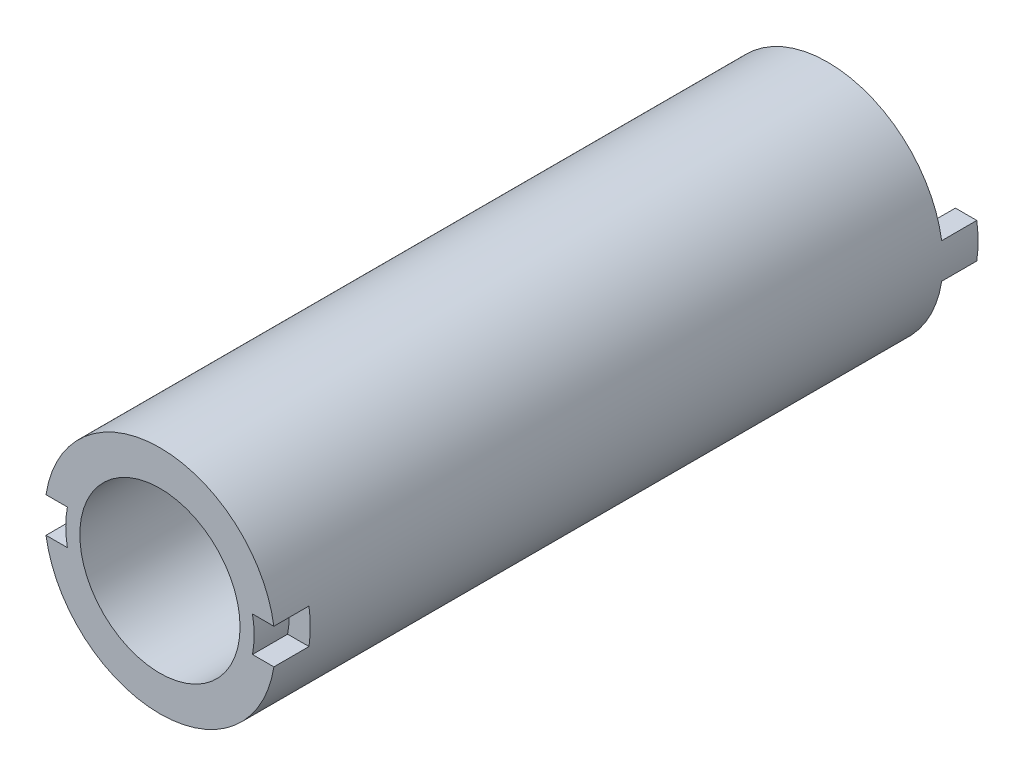
from build123d import *

# Parameters (mm, degrees)
SKETCH1_R           = 16.4
SKETCH1_R_2         = 11.4
BOSS_EXTRUDE1_DEPTH = 95
BOSS_EXTRUDE2_START = 5
BOSS_EXTRUDE2_DEPTH = 5
CUT_EXTRUDE1_START  = -5
CUT_EXTRUDE1_DEPTH  = 5


with BuildPart() as part:
    # Sketch1 → Boss-Extrude1 (new body)
    with BuildSketch(Plane.XY):
        Circle(SKETCH1_R)
        Circle(SKETCH1_R_2, mode=Mode.SUBTRACT)
    extrude(amount=BOSS_EXTRUDE1_DEPTH)

    # Sketch3 → Boss-Extrude2 (add)
    with BuildSketch(Plane(origin=(0, 0, 0), x_dir=(-1, 0, 0), z_dir=(0, 0, -1)).offset(BOSS_EXTRUDE2_START)):
        with BuildLine():
            Line((13.164725595, 2.5), (16.208331191, 2.5))
            ThreePointArc((16.208331191, 2.5), (16.4, 0), (16.208331191, -2.5))
            Line((16.208331191, -2.5), (13.164725595, -2.5))
            ThreePointArc((13.164725595, -2.5), (13.4, 0), (13.164725595, 2.5))
        make_face()
        with BuildLine():
            Line((-16.208331191, 2.5), (-13.164725595, 2.5))
            ThreePointArc((-13.164725595, 2.5), (-13.4, 0), (-13.164725595, -2.5))
            Line((-13.164725595, -2.5), (-16.208331191, -2.5))
            ThreePointArc((-16.208331191, -2.5), (-16.4, 0), (-16.208331191, 2.5))
        make_face()
    extrude(amount=-BOSS_EXTRUDE2_DEPTH)

    # Sketch4 → Cut-Extrude1 (cut)
    with BuildSketch(Plane.XY.offset(95).offset(CUT_EXTRUDE1_START)):
        with BuildLine():
            Line((13.164725595, 2.5), (16.208331191, 2.5))
            ThreePointArc((16.208331191, 2.5), (16.4, 0), (16.208331191, -2.5))
            Line((16.208331191, -2.5), (13.164725595, -2.5))
            ThreePointArc((13.164725595, -2.5), (13.4, 0), (13.164725595, 2.5))
        make_face()
        with BuildLine():
            Line((-16.208331191, 2.5), (-13.164725595, 2.5))
            ThreePointArc((-13.164725595, 2.5), (-13.4, 0), (-13.164725595, -2.5))
            Line((-13.164725595, -2.5), (-16.208331191, -2.5))
            ThreePointArc((-16.208331191, -2.5), (-16.4, 0), (-16.208331191, 2.5))
        make_face()
    extrude(amount=CUT_EXTRUDE1_DEPTH, mode=Mode.SUBTRACT)


solid = part.part
